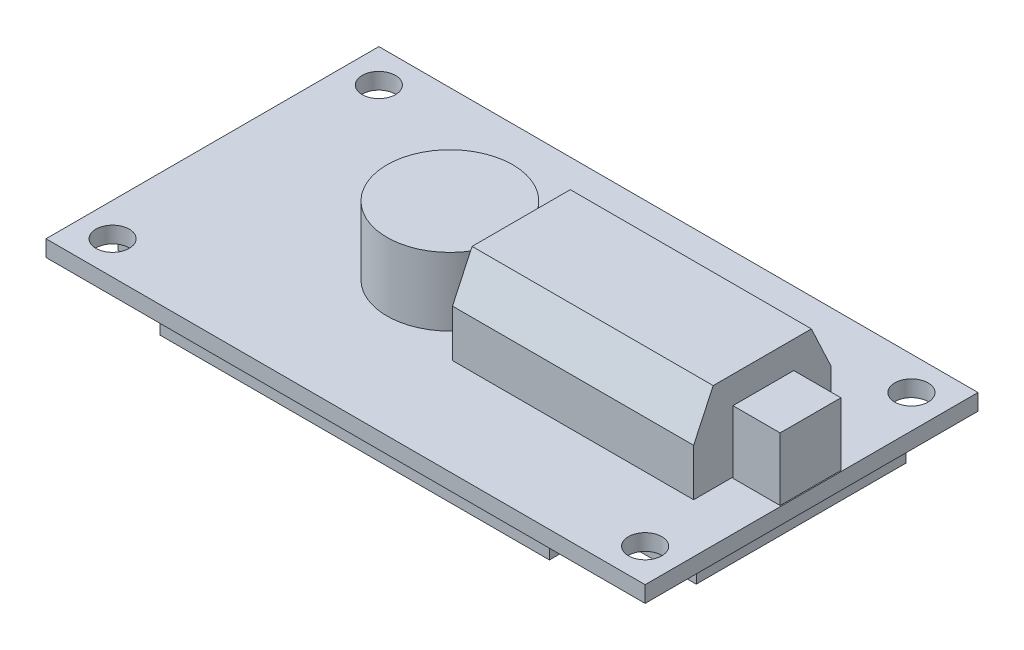
from build123d import *
from OCP.BRepFilletAPI import BRepFilletAPI_MakeChamfer

# Parameters (mm, degrees)
SKETCH1_W                = 57.15
SKETCH1_H                = 31.75
PCB_DEPTH                = 1.55
SKETCH2_R                = 1.59
MOUNT_HOLES_DEPTH        = 66.395622942
SKETCH4_R                = 6
SPEAKER_DEPTH            = 6.5
SKETCH5_W                = 23
SKETCH5_H                = 13.1
TERMINALS_DEPTH          = 8.5
CHAMFER1_SIZE            = 4
CHAMFER1_SIZE2           = 1.865230633
SKETCH7_W                = 4.5
SKETCH7_H                = 5.8
BATTERY_PORT_DEPTH       = 6
SKETCH11_W               = 8
SKETCH11_H               = 5.7
USB_PORT_DEPTH           = 3
SKETCH14_W               = 9
SKETCH14_H               = 20
SKETCH14_W_2             = 37.15
SKETCH14_H_2             = 30
SURFACE_COMPONENTS_DEPTH = 1.85


with BuildPart() as part:
    # Sketch1 → PCB (new body)
    with BuildSketch(Plane(origin=(0, 0, 0), x_dir=(1, 0, 0), z_dir=(0, 1, 0))):
        with Locations((28.575, -15.875)):
            Rectangle(SKETCH1_W, SKETCH1_H)
    extrude(amount=PCB_DEPTH)

    # Sketch2 → Mount Holes (cut, through all)
    with BuildSketch(Plane(origin=(0, 1.55, 0), x_dir=(1, 0, 0), z_dir=(0, 1, 0))):
        with Locations(Location((3.175, -3.175, 0), (0, 0, 270))):
            Circle(SKETCH2_R)
        with Locations(Location((3.175, -28.575, 0), (0, 0, 270))):
            Circle(SKETCH2_R)
        with Locations(Location((53.975, -28.575, 0), (0, 0, 270))):
            Circle(SKETCH2_R)
        with Locations(Location((53.975, -3.175, 0), (0, 0, 270))):
            Circle(SKETCH2_R)
    extrude(amount=-MOUNT_HOLES_DEPTH, mode=Mode.SUBTRACT)

    # Sketch4 → Speaker (add)
    with BuildSketch(Plane(origin=(0, 1.55, 0), x_dir=(1, 0, 0), z_dir=(0, 1, 0))):
        with Locations(Location((22.65, -15.875, 0), (0, 0, 90))):
            Circle(SKETCH4_R)
    extrude(amount=SPEAKER_DEPTH)

    # Sketch5 → Terminals (add)
    with BuildSketch(Plane(origin=(0, 1.55, 0), x_dir=(1, 0, 0), z_dir=(0, 1, 0))):
        with Locations((40.95, -15.875)):
            Rectangle(SKETCH5_W, SKETCH5_H)
    extrude(amount=TERMINALS_DEPTH)

    # Chamfer1: one chamfer whose edges measure the first distance from different faces: ONE call of the kernel's chamfer builder (chamfer() names one face for all edges)
    chamfer1_edges_1 = [part.edges().sort_by_distance(p)[0] for p in [
        (40.95, 10.05, 22.425),
    ]]
    chamfer1_side_1 = [part.faces().sort_by_distance(p)[0] for p in [
        (40.95, 5.8, 22.425),
    ]]
    chamfer1_edges_2 = [part.edges().sort_by_distance(p)[0] for p in [
        (40.95, 10.05, 9.325),
    ]]
    chamfer1_side_2 = [part.faces().sort_by_distance(p)[0] for p in [
        (40.95, 5.8, 9.325),
    ]]
    chamfer1 = BRepFilletAPI_MakeChamfer(part.part.solid().wrapped)
    for e in chamfer1_edges_1:
        chamfer1.Add(CHAMFER1_SIZE, CHAMFER1_SIZE2, e.wrapped, chamfer1_side_1[0].wrapped)  # the first distance lies on this face
    for e in chamfer1_edges_2:
        chamfer1.Add(CHAMFER1_SIZE, CHAMFER1_SIZE2, e.wrapped, chamfer1_side_2[0].wrapped)  # the first distance lies on this face
    add(Compound.cast(chamfer1.Shape()), mode=Mode.REPLACE)

    # Sketch7 → Battery Port (add)
    with BuildSketch(Plane(origin=(0, 1.55, 0), x_dir=(1, 0, 0), z_dir=(0, 1, 0))):
        with Locations((54.8, -15.875)):
            Rectangle(SKETCH7_W, SKETCH7_H)
    extrude(amount=BATTERY_PORT_DEPTH)



with BuildPart() as body_2:
    # Sketch11 → USB Port (new body)
    with BuildSketch(Plane(origin=(0, 0, 0), x_dir=(-1, 0, 0), z_dir=(0, -1, 0))):
        with Locations((-28.05, -2.75)):
            Rectangle(SKETCH11_W, SKETCH11_H)
    extrude(amount=USB_PORT_DEPTH)


with BuildPart() as part_1:
    add(part.part)

    add(body_2.part)  # Surface Components merges body 2
    # Sketch14 → Surface Components (add)
    with BuildSketch(Plane.XZ):
        with Locations((5.5, 15.875)):
            Rectangle(SKETCH14_W, SKETCH14_H)
        with Locations((28.575, 15.875)):
            Rectangle(SKETCH14_W_2, SKETCH14_H_2)
        with Locations((51.65, 15.875)):
            Rectangle(SKETCH14_W, SKETCH14_H)
    extrude(amount=SURFACE_COMPONENTS_DEPTH)


solid = part_1.part
